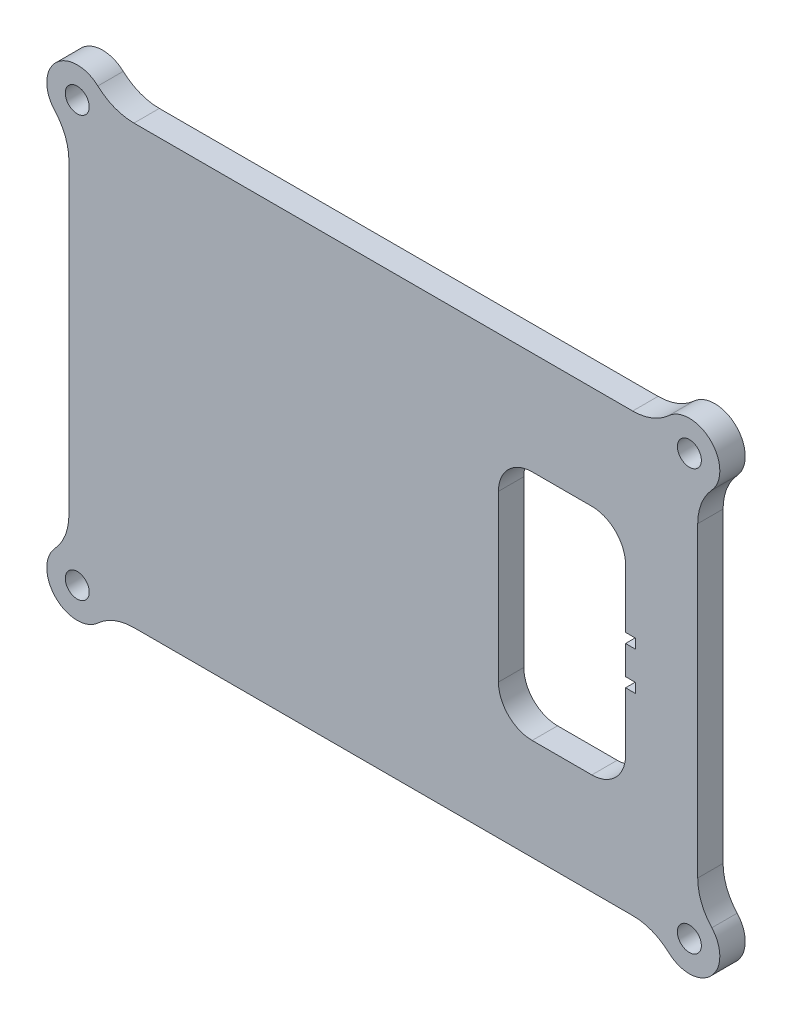
from build123d import *

# Parameters (mm, degrees)
SKETCH2_R           = 2.25
BOSS_EXTRUDE1_DEPTH = 4.7625


with BuildPart() as part:
    # Sketch2 → Boss-Extrude1 (new body)
    with BuildSketch(Plane.XY):
        with BuildLine():
            Line((-68.055152616, 8.002600295), (-68.055152616, -49.587169128))
            ThreePointArc((-68.055152616, -49.587169128), (-68.738717517, -53.22090509), (-70.695960025, -56.35786218))
            ThreePointArc((-70.695960025, -56.35786218), (-70.531296713, -64.268428513), (-62.62073038, -64.433091825))
            ThreePointArc((-62.62073038, -64.433091825), (-59.48377329, -62.475849317), (-55.850037328, -61.792284416))
            Line((-55.850037328, -61.792284416), (37.739732095, -61.792284416))
            ThreePointArc((37.739732095, -61.792284416), (41.373468058, -62.475849317), (44.510425147, -64.433091825))
            ThreePointArc((44.510425147, -64.433091825), (52.420991481, -64.268428513), (52.585654792, -56.35786218))
            ThreePointArc((52.585654792, -56.35786218), (50.628412285, -53.22090509), (49.944847384, -49.587169128))
            Line((49.944847384, -49.587169128), (49.944847384, 8.002600295))
            ThreePointArc((49.944847384, 8.002600295), (50.628412285, 11.636336257), (52.585654792, 14.773293347))
            ThreePointArc((52.585654792, 14.773293347), (52.420991481, 22.683859681), (44.510425147, 22.848522992))
            ThreePointArc((44.510425147, 22.848522992), (41.373468058, 20.891280484), (37.739732095, 20.207715584))
            Line((37.739732095, 20.207715584), (-55.850037328, 20.207715584))
            ThreePointArc((-55.850037328, 20.207715584), (-59.48377329, 20.891280484), (-62.62073038, 22.848522992))
            ThreePointArc((-62.62073038, 22.848522992), (-70.531296713, 22.683859681), (-70.695960025, 14.773293347))
            ThreePointArc((-70.695960025, 14.773293347), (-68.738717517, 11.636336257), (-68.055152616, 8.002600295))
        make_face()
        with Locations(Location((-66.490181459, 18.642744426, 0), (0, 0, 180))):
            Circle(SKETCH2_R, mode=Mode.SUBTRACT)
        with Locations(Location((48.379876226, 18.642744426, 0), (0, 0, 180))):
            Circle(SKETCH2_R, mode=Mode.SUBTRACT)
        with Locations(Location((48.379876226, -60.227313259, 0), (0, 0, 180))):
            Circle(SKETCH2_R, mode=Mode.SUBTRACT)
        with Locations(Location((-66.490181459, -60.227313259, 0), (0, 0, 180))):
            Circle(SKETCH2_R, mode=Mode.SUBTRACT)
        with BuildLine():
            Line((30.076846635, 0.887717024), (18.876846635, 0.88771689))
            ThreePointArc((18.876846635, 0.88771689), (14.404396266, -0.964832772), (12.551846711, -5.437283185))
            Line((12.551846711, -5.437283185), (12.55184708, -36.437283185))
            ThreePointArc((12.55184708, -36.437283185), (14.404396743, -40.909733554), (18.876847156, -42.76228311))
            Line((18.876847156, -42.76228311), (30.076847156, -42.762282976))
            ThreePointArc((30.076847156, -42.762282976), (34.549297525, -40.909733314), (36.40184708, -36.437282901))
            Line((36.40184708, -36.437282901), (36.401846949, -25.437282901))
            Line((36.401846949, -25.437282901), (38.276846863, -25.437282901))
            Line((38.276846863, -25.437282901), (38.276846863, -23.637282901))
            Line((38.276846863, -23.637282901), (36.401846928, -23.637282901))
            Line((36.401846928, -23.637282901), (36.401846863, -18.237282901))
            Line((36.401846863, -18.237282901), (38.276846863, -18.237282879))
            Line((38.276846863, -18.237282879), (38.276846842, -16.437282879))
            Line((38.276846842, -16.437282879), (36.401846842, -16.437282901))
            Line((36.401846842, -16.437282901), (36.401846711, -5.437282901))
            ThreePointArc((36.401846711, -5.437282901), (34.549297048, -0.964832532), (30.076846635, 0.887717024))
        make_face(mode=Mode.SUBTRACT)
    extrude(amount=BOSS_EXTRUDE1_DEPTH)


solid = part.part
